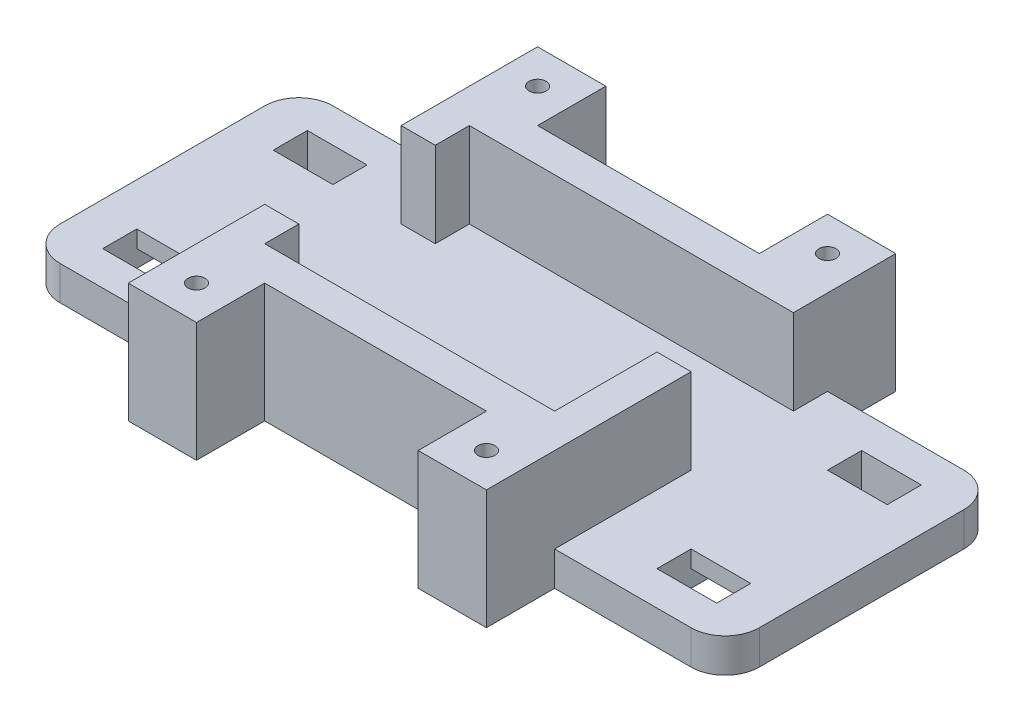
from build123d import *

# Parameters (mm, degrees)
SKETCH1_W           = 21
SKETCH1_H           = 16
SKETCH1_W_2         = 17
SKETCH1_H_2         = 12
BOSS_EXTRUDE1_DEPTH = 2
SKETCH1_6_W         = 21
SKETCH1_6_H         = 16
SKETCH1_6_W_2       = 17
SKETCH1_6_H_2       = 12
BOSS_EXTRUDE2_DEPTH = 7
SKETCH2_W           = 41
SKETCH2_H           = 16
BOSS_EXTRUDE3_DEPTH = 2
SKETCH3_W           = 3.5
SKETCH3_H           = 2
CUT_EXTRUDE1_DEPTH  = 33.954514107
SKETCH4_W           = 3.5
SKETCH4_H           = 8
CUT_EXTRUDE2_DEPTH  = 1
CUT_EXTRUDE3_START  = -7
SKETCH5_W           = 2
SKETCH5_H           = 8
SKETCH5_H_2         = 6
CUT_EXTRUDE3_DEPTH  = 7
CUT_EXTRUDE4_DEPTH  = 2
CUT_EXTRUDE5_DEPTH  = 2
SKETCH9_W           = 4
SKETCH9_H           = 4
BOSS_EXTRUDE4_DEPTH = 7
SKETCH10_R          = 0.5
CUT_EXTRUDE6_DEPTH  = 35.84250278
SKETCH11_W          = 3.5
SKETCH11_H          = 8
CUT_EXTRUDE7_DEPTH  = 1
FILLET1_R           = 2


with BuildPart() as part:
    # Sketch1 → Boss-Extrude1 (new body)
    # profile 1 of 2: a face of its own
    with BuildSketch(Plane(origin=(0, 0, 0), x_dir=(1, 0, 0), z_dir=(0, 1, 0))):
        with Locations((-8.5, 6)):
            Rectangle(SKETCH1_W, SKETCH1_H)
        with Locations((-8.5, 6)):
            Rectangle(SKETCH1_W_2, SKETCH1_H_2, mode=Mode.SUBTRACT)
    # profile 2 of 2: a face of its own
    with BuildSketch(Plane(origin=(0, 0, 0), x_dir=(1, 0, 0), z_dir=(0, 1, 0))):
        with Locations((-8.5, 6)):
            Rectangle(SKETCH1_W_2, SKETCH1_H_2)
    extrude(amount=BOSS_EXTRUDE1_DEPTH)

    # Sketch1<6> → Boss-Extrude2 (add)
    with BuildSketch(Plane(origin=(0, 0, 0), x_dir=(1, 0, 0), z_dir=(0, 1, 0))):
        with Locations((-8.5, 6)):
            Rectangle(SKETCH1_6_W, SKETCH1_6_H)
        with Locations((-8.5, 6)):
            Rectangle(SKETCH1_6_W_2, SKETCH1_6_H_2, mode=Mode.SUBTRACT)
    extrude(amount=BOSS_EXTRUDE2_DEPTH)

    # Sketch2 → Boss-Extrude3 (add)
    with BuildSketch(Plane.XZ):
        with Locations((-8.5, -6)):
            Rectangle(SKETCH2_W, SKETCH2_H)
    extrude(amount=BOSS_EXTRUDE3_DEPTH)

    # Sketch3 → Cut-Extrude1 (cut, through all)
    with BuildSketch(Plane(origin=(0, 0, 0), x_dir=(1, 0, 0), z_dir=(0, 1, 0))):
        with Locations((-24.75, 11)):
            Rectangle(SKETCH3_W, SKETCH3_H)
        with Locations((-24.75, 1)):
            Rectangle(SKETCH3_W, SKETCH3_H)
        with Locations((7.75, 11)):
            Rectangle(SKETCH3_W, SKETCH3_H)
        with Locations((7.75, 1)):
            Rectangle(SKETCH3_W, SKETCH3_H)
    extrude(amount=-CUT_EXTRUDE1_DEPTH, mode=Mode.SUBTRACT)

    # Sketch4 → Cut-Extrude2 (cut)
    with BuildSketch(Plane.XZ.offset(2)):
        with Locations((-24.75, -6)):
            Rectangle(SKETCH4_W, SKETCH4_H)
    extrude(amount=-CUT_EXTRUDE2_DEPTH, mode=Mode.SUBTRACT)

    # Sketch5 → Cut-Extrude3 (cut)
    with BuildSketch(Plane(origin=(0, 7, 0), x_dir=(1, 0, 0), z_dir=(0, 1, 0)).offset(CUT_EXTRUDE3_START)):
        with Locations((-18, 6)):
            Rectangle(SKETCH5_W, SKETCH5_H)
        with Locations((1, 9)):
            Rectangle(SKETCH5_W, SKETCH5_H_2)
    extrude(amount=CUT_EXTRUDE3_DEPTH, mode=Mode.SUBTRACT)

    # Sketch7 → Cut-Extrude4 (cut)
    with BuildSketch(Plane(origin=(0, 2, 0), x_dir=(1, 0, 0), z_dir=(0, 1, 0))):
        Polygon((-17, 2), (-17, 0), (0, 0), (0, 6), (0, 12), (-17, 12), (-17, 10), align=None)
    extrude(amount=-CUT_EXTRUDE4_DEPTH, mode=Mode.SUBTRACT)

    # Sketch8 → Cut-Extrude5 (cut)
    with BuildSketch(Plane(origin=(0, 7, 0), x_dir=(1, 0, 0), z_dir=(0, 1, 0))):
        Polygon((-17, 2), (-19, 2), (-19, -2), (2, -2), (2, 6), (0, 6), (0, 0), (-17, 0), align=None)
        Polygon((-19, 10), (-17, 10), (-17, 12), (2, 12), (2, 14), (-19, 14), align=None)
    extrude(amount=-CUT_EXTRUDE5_DEPTH, mode=Mode.SUBTRACT)

    # Sketch9 → Boss-Extrude4 (add)
    with BuildSketch(Plane(origin=(0, 5, 0), x_dir=(1, 0, 0), z_dir=(0, 1, 0))):
        with Locations((-17, 16)):
            Rectangle(SKETCH9_W, SKETCH9_H)
        with Locations((0, 16)):
            Rectangle(SKETCH9_W, SKETCH9_H)
        with Locations((0, -4)):
            Rectangle(SKETCH9_W, SKETCH9_H)
        with Locations((-17, -4)):
            Rectangle(SKETCH9_W, SKETCH9_H)
    extrude(amount=-BOSS_EXTRUDE4_DEPTH)

    # Sketch10 → Cut-Extrude6 (cut, through all)
    with BuildSketch(Plane(origin=(0, 5, 0), x_dir=(1, 0, 0), z_dir=(0, 1, 0))):
        with Locations(Location((-17, 16, 0), (0, 0, 270))):
            Circle(SKETCH10_R)
        with Locations(Location((0, 16, 0), (0, 0, 270))):
            Circle(SKETCH10_R)
        with Locations(Location((0, -4, 0), (0, 0, 270))):
            Circle(SKETCH10_R)
        with Locations(Location((-17, -4, 0), (0, 0, 270))):
            Circle(SKETCH10_R)
    extrude(amount=-CUT_EXTRUDE6_DEPTH, mode=Mode.SUBTRACT)

    # Sketch11 → Cut-Extrude7 (cut)
    with BuildSketch(Plane.XZ.offset(2)):
        with Locations((7.75, -6)):
            Rectangle(SKETCH11_W, SKETCH11_H)
    extrude(amount=-CUT_EXTRUDE7_DEPTH, mode=Mode.SUBTRACT)

    # Fillet1
    fillet1_edges = [part.edges().sort_by_distance(p)[0] for p in [
        (-29, -1, 2),
        (-29, -1, -14),
        (12, -1, -14),
        (12, -1, 2),
    ]]
    fillet(fillet1_edges, radius=FILLET1_R)


solid = part.part
